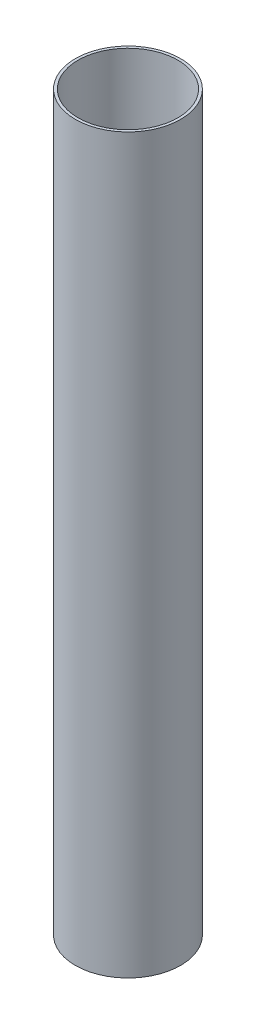
from build123d import *

# Parameters (mm, degrees)
SKETCH1_R           = 40.1574
SKETCH1_R_2         = 38.1
BOSS_EXTRUDE1_DEPTH = 558.8


with BuildPart() as part:
    # Sketch1 → Boss-Extrude1 (new body)
    with BuildSketch(Plane(origin=(0, 0, 0), x_dir=(1, 0, 0), z_dir=(0, 1, 0))):
        with Locations(Location((0, 0, 0), (0, 0, 270))):
            Circle(SKETCH1_R)
        with Locations(Location((0, 0, 0), (0, 0, 270))):
            Circle(SKETCH1_R_2, mode=Mode.SUBTRACT)
    extrude(amount=-BOSS_EXTRUDE1_DEPTH)


solid = part.part
